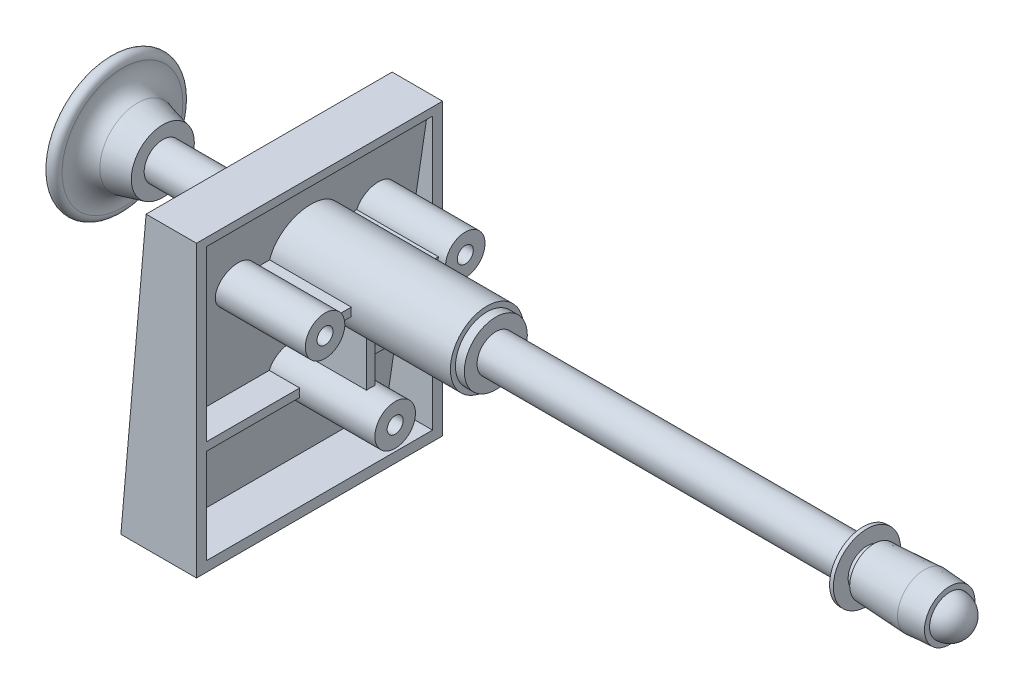
from build123d import *
from build123d.topology import SkipClean

# Parameters (mm, degrees)
SKETCH1_W                       = 61.976
SKETCH1_H                       = 73.025
BOSS_EXTRUDE1_DEPTH             = 19.05
CUT_EXTRUDE1_DEPTH              = 98.655403
SKETCH4_W                       = 55.626
SKETCH4_H                       = 66.950567
CUT_EXTRUDE3_DEPTH              = 3.175
CUT_EXTRUDE5_REACH              = 83.583
SKETCH3_W                       = 56.896
SKETCH3_H                       = 68.4911
BOSS_EXTRUDE2_REACH             = 83.583
BOSS_EXTRUDE4_START             = 19.05
SKETCH12_R                      = 5.11175
BOSS_EXTRUDE4_DEPTH             = 19.05
BOSS_EXTRUDE3_REACH             = 83.583
BOSS_EXTRUDE3_DIRECTION_2_DEPTH = 19.05
CUT_EXTRUDE6_DEPTH              = 6.1214
CUT_EXTRUDE7_DEPTH              = 1.905
BOSS_EXTRUDE5_START             = 23.114
SKETCH15_R                      = 9.2075
BOSS_EXTRUDE5_DEPTH             = 23.114
SKETCH16_R                      = 7.9375
BOSS_EXTRUDE6_DEPTH             = 2.2352
F_10_32_TAPPED_HOLE1_D          = 4.0386
F_10_32_TAPPED_HOLE1_DEPTH      = 22.86
F_10_32_TAPPED_HOLE1_TIP        = 1.213318
SKETCH17_R                      = 4.73075
BOSS_EXTRUDE7_DEPTH             = 95.25
SKETCH19_R                      = 8.4582
BOSS_EXTRUDE8_DEPTH             = 0.9525
BOSS_EXTRUDE9_REACH             = 201.297
SKETCH24_R                      = 9.2075
BOSS_EXTRUDE10_START            = 1.3716
SKETCH25_R                      = 7.9375
BOSS_EXTRUDE10_DEPTH            = 1.3716
SKETCH26_R                      = 4.69265
BOSS_EXTRUDE11_DEPTH            = 19.05


with BuildPart() as part:
    # Sketch1 → Boss-Extrude1 (new body)
    with BuildSketch(Plane(origin=(0, 0, 0), x_dir=(0, 0, -1), z_dir=(1, 0, 0))):
        with Locations((0, 36.5125)):
            Rectangle(SKETCH1_W, SKETCH1_H)
    extrude(amount=-BOSS_EXTRUDE1_DEPTH)

    # Sketch2 → Cut-Extrude1 (cut, through all)
    with BuildSketch(Plane.XY.offset(30.988)):
        Polygon((-12.7, 73.025), (-19.05, 0), (-19.05, 73.025), align=None)
    extrude(amount=-CUT_EXTRUDE1_DEPTH, mode=Mode.SUBTRACT)

    # Sketch4 → Cut-Extrude3 (cut)
    with BuildSketch(Plane(origin=(-18.907036, 1.64409, 0), x_dir=(0, 0, 1), z_dir=(-0.9962405881956831, 0.08662961636484201, 0))):
        with Locations((0, 34.999989)):
            Rectangle(SKETCH4_W, SKETCH4_H)
    extrude(amount=-CUT_EXTRUDE3_DEPTH, mode=Mode.SUBTRACT)

    # Cut-Extrude5: up to this plane
    cut_extrude5_end = Plane(origin=(-11.663084, 1.746979, 0), z_dir=(-0.9889672225345182, 0.14813450898545183, 0))
    # Sketch3 → Cut-Extrude5 (cut, up to the surface)
    with BuildSketch(Plane(origin=(0, 0, 0), x_dir=(0, 0, -1), z_dir=(1, 0, 0)), mode=Mode.PRIVATE) as cut_extrude5_sk1:
        with Locations((0, 36.78555)):
            Rectangle(SKETCH3_W, SKETCH3_H)
    cut_extrude5_tool1 = split(extrude(cut_extrude5_sk1.sketch, amount=-CUT_EXTRUDE5_REACH, mode=Mode.PRIVATE), bisect_by=cut_extrude5_end, keep=Keep.BOTH, mode=Mode.PRIVATE)
    add(cut_extrude5_tool1.solids().sort_by_distance((0, 36.78555, 0))[0], mode=Mode.SUBTRACT)

    # Boss-Extrude2: up to this plane
    boss_extrude2_end = Plane(origin=(-11.663084, 1.746979, 0), z_dir=(-0.9889672225345182, 0.14813450898545183, 0))
    # Sketch9 → Boss-Extrude2 (add, up to the surface)
    with BuildSketch(Plane(origin=(0, 0, 0), x_dir=(0, 0, -1), z_dir=(1, 0, 0)), mode=Mode.PRIVATE) as boss_extrude2_sk1:
        with BuildLine():
            Line((-5.004545, 28.4607), (-28.448, 28.4607))
            Line((-28.448, 28.4607), (-28.448, 26.3779))
            Line((-28.448, 26.3779), (-5.004545, 26.3779))
            ThreePointArc((-5.004545, 26.3779), (0, 22.30755), (5.004545, 26.3779))
            Line((5.004545, 26.3779), (28.448, 26.3779))
            Line((28.448, 26.3779), (28.448, 28.4607))
            Line((28.448, 28.4607), (5.004545, 28.4607))
            ThreePointArc((5.004545, 28.4607), (0, 32.53105), (-5.004545, 28.4607))
        make_face()
    boss_extrude2_tool1 = split(extrude(boss_extrude2_sk1.sketch, amount=-BOSS_EXTRUDE2_REACH, mode=Mode.PRIVATE), bisect_by=boss_extrude2_end, keep=Keep.BOTH, mode=Mode.PRIVATE)
    add(boss_extrude2_tool1.solids().sort_by_distance((0, 27.4193, 0))[0])

    # Sketch12 → Boss-Extrude4 (add)
    with BuildSketch(Plane(origin=(0, 0, 0), x_dir=(0, 0, -1), z_dir=(1, 0, 0)).offset(BOSS_EXTRUDE4_START)):
        with Locations((0, 27.4193)):
            Circle(SKETCH12_R)
    extrude(amount=-BOSS_EXTRUDE4_DEPTH)

    # Boss-Extrude3: up to this plane
    boss_extrude3_end = Plane(origin=(-11.663084, 1.746979, 0), z_dir=(-0.9889672225345182, 0.14813450898545183, 0))
    # Sketch11 → Boss-Extrude3 (add, up to the surface)
    with BuildSketch(Plane(origin=(0, 0, 0), x_dir=(0, 0, -1), z_dir=(1, 0, 0)), mode=Mode.PRIVATE) as boss_extrude3_sk1:
        with BuildLine():
            Line((-1.0414, 46.560133), (-1.0414, 32.423845))
            ThreePointArc((-1.0414, 32.423845), (0, 32.53105), (1.0414, 32.423845))
            Line((1.0414, 32.423845), (1.0414, 46.560133))
            ThreePointArc((1.0414, 46.560133), (6.510686, 49.197864), (9.148417, 54.66715))
            Line((9.148417, 54.66715), (12.797584, 54.66715))
            ThreePointArc((12.797584, 54.66715), (22.6314, 55.70855), (12.797584, 56.74995))
            Line((12.797584, 56.74995), (9.148417, 56.74995))
            ThreePointArc((9.148417, 56.74995), (0, 64.91605), (-9.148417, 56.74995))
            Line((-9.148417, 56.74995), (-12.797584, 56.74995))
            ThreePointArc((-12.797584, 56.74995), (-22.6314, 55.70855), (-12.797584, 54.66715))
            Line((-12.797584, 54.66715), (-9.148417, 54.66715))
            ThreePointArc((-9.148417, 54.66715), (-6.510686, 49.197864), (-1.0414, 46.560133))
        make_face()
    boss_extrude3_tool1 = split(extrude(boss_extrude3_sk1.sketch, amount=-BOSS_EXTRUDE3_REACH, mode=Mode.PRIVATE), bisect_by=boss_extrude3_end, keep=Keep.BOTH, mode=Mode.PRIVATE)
    add(boss_extrude3_tool1.solids().sort_by_distance((0, 54.692148, 0))[0])

    # Sketch11 → Boss-Extrude3 direction 2 (add)
    with BuildSketch(Plane(origin=(0, 0, 0), x_dir=(0, 0, -1), z_dir=(1, 0, 0))):
        with BuildLine():
            Line((-1.0414, 46.560133), (-1.0414, 32.423845))
            ThreePointArc((-1.0414, 32.423845), (0, 32.53105), (1.0414, 32.423845))
            Line((1.0414, 32.423845), (1.0414, 46.560133))
            ThreePointArc((1.0414, 46.560133), (6.510686, 49.197864), (9.148417, 54.66715))
            Line((9.148417, 54.66715), (12.797584, 54.66715))
            ThreePointArc((12.797584, 54.66715), (22.6314, 55.70855), (12.797584, 56.74995))
            Line((12.797584, 56.74995), (9.148417, 56.74995))
            ThreePointArc((9.148417, 56.74995), (0, 64.91605), (-9.148417, 56.74995))
            Line((-9.148417, 56.74995), (-12.797584, 56.74995))
            ThreePointArc((-12.797584, 56.74995), (-22.6314, 55.70855), (-12.797584, 54.66715))
            Line((-12.797584, 54.66715), (-9.148417, 54.66715))
            ThreePointArc((-9.148417, 54.66715), (-6.510686, 49.197864), (-1.0414, 46.560133))
        make_face()
    extrude(amount=BOSS_EXTRUDE3_DIRECTION_2_DEPTH)

    # Sketch13 → Cut-Extrude6 (cut)
    with BuildSketch(Plane(origin=(19.05, 0, 0), x_dir=(0, 0, -1), z_dir=(1, 0, 0))):
        with BuildLine():
            Line((-1.0414, 46.560133), (-1.0414, 32.423845))
            ThreePointArc((-1.0414, 32.423845), (0, 32.53105), (1.0414, 32.423845))
            Line((1.0414, 32.423845), (1.0414, 46.560133))
            ThreePointArc((1.0414, 46.560133), (0, 46.50105), (-1.0414, 46.560133))
        make_face()
    extrude(amount=-CUT_EXTRUDE6_DEPTH, mode=Mode.SUBTRACT)

    # Sketch14 → Cut-Extrude7 (cut)
    with SkipClean():  # the faces are left unmerged after this step: merging them gives an invalid solid
        with BuildSketch(Plane(origin=(19.05, 0, 0), x_dir=(0, 0, -1), z_dir=(1, 0, 0))):
            with BuildLine():
                Line((-9.148417, 54.66715), (-12.797584, 54.66715))
                ThreePointArc((-12.797584, 54.66715), (-12.6873, 55.70855), (-12.797584, 56.74995))
                Line((-12.797584, 56.74995), (-9.148417, 56.74995))
                ThreePointArc((-9.148417, 56.74995), (-9.2075, 55.70855), (-9.148417, 54.66715))
            make_face()
            with BuildLine():
                Line((9.148417, 54.66715), (12.797584, 54.66715))
                ThreePointArc((12.797584, 54.66715), (12.6873, 55.70855), (12.797584, 56.74995))
                Line((12.797584, 56.74995), (9.148417, 56.74995))
                ThreePointArc((9.148417, 56.74995), (9.2075, 55.70855), (9.148417, 54.66715))
            make_face()
        extrude(amount=-CUT_EXTRUDE7_DEPTH, mode=Mode.SUBTRACT)

    # Sketch15 → Boss-Extrude5 (add)
    with SkipClean():  # the faces are left unmerged after this step: merging them gives an invalid solid
        with BuildSketch(Plane(origin=(19.05, 0, 0), x_dir=(0, 0, -1), z_dir=(1, 0, 0)).offset(BOSS_EXTRUDE5_START)):
            with Locations(Location((0, 55.70855, 0), (0, 0, 173.505753))):
                Circle(SKETCH15_R)
        extrude(amount=-BOSS_EXTRUDE5_DEPTH)

    # Sketch16 → Boss-Extrude6 (add)
    with SkipClean():  # the faces are left unmerged after this step: merging them gives an invalid solid
        with BuildSketch(Plane(origin=(42.164, 0, 0), x_dir=(0, 0, -1), z_dir=(1, 0, 0))):
            with Locations((0, 55.70855)):
                Circle(SKETCH16_R)
        extrude(amount=BOSS_EXTRUDE6_DEPTH)

    # #10-32 Tapped Hole1
    with Locations(Plane(origin=(19.05, 0, 0), x_dir=(0, 0, -1), z_dir=(1, 0, 0))):
        with Locations((-17.65935, 55.70855), (17.65935, 55.70855), (0, 27.4193)):
            Hole(F_10_32_TAPPED_HOLE1_D / 2, depth=F_10_32_TAPPED_HOLE1_DEPTH)
            with Locations((0, 0, -(F_10_32_TAPPED_HOLE1_DEPTH + F_10_32_TAPPED_HOLE1_TIP / 2))):  # 118° drill point
                Cone(0, F_10_32_TAPPED_HOLE1_D / 2, F_10_32_TAPPED_HOLE1_TIP, mode=Mode.SUBTRACT)

    # Sketch17 → Boss-Extrude7 (add)
    with SkipClean():  # the faces are left unmerged after this step: merging them gives an invalid solid
        with BuildSketch(Plane(origin=(44.3992, 0, 0), x_dir=(0, 0, -1), z_dir=(1, 0, 0))):
            with Locations((0, 55.70855)):
                Circle(SKETCH17_R)
        extrude(amount=BOSS_EXTRUDE7_DEPTH)

    # Sketch18 → Revolve1 (revolve)
    with SkipClean():  # the faces are left unmerged after this step: merging them gives an invalid solid
        with BuildSketch(Plane.XY, mode=Mode.PRIVATE) as revolve1_sk:
            with BuildLine():
                Line((139.6492, 55.70855), (163.7792, 55.70855))
                ThreePointArc((163.7792, 55.70855), (162.296882, 59.287182), (158.71825, 60.7695))
                Line((158.71825, 60.7695), (158.71825, 62.05855))
                Line((158.71825, 62.05855), (152.36825, 62.50305))
                Line((152.36825, 62.50305), (139.6492, 61.82995))
                Line((139.6492, 61.82995), (139.6492, 55.70855))
            make_face()
        revolve(revolve1_sk.sketch.rotate(Axis((139.6492, 55.70855, 0), (1, 0, 0)), 83.505753), axis=Axis((139.6492, 55.70855, 0), (1, 0, 0)))

    # Sketch19 → Boss-Extrude8 (add)
    with SkipClean():  # the faces are left unmerged after this step: merging them gives an invalid solid
        with BuildSketch(Plane.ZY.offset(-137.8712)):
            with Locations(Location((0, 55.70855, 0), (0, 0, 180))):
                Circle(SKETCH19_R)
        extrude(amount=BOSS_EXTRUDE8_DEPTH)

    # Boss-Extrude9: up to this plane
    with SkipClean():  # the faces are left unmerged after this step: merging them gives an invalid solid
        boss_extrude9_end = Plane(origin=(-15.743972, 1.369041, 0), z_dir=(-0.996240588195683, 0.086629616364842, 0))
        # Sketch24 → Boss-Extrude9 (add, up to the surface)
        with BuildSketch(Plane(origin=(-19.05, 0, 0), x_dir=(0, 0, -1), z_dir=(1, 0, 0)), mode=Mode.PRIVATE) as boss_extrude9_sk1:
            with Locations(Location((0, 55.70855, 0), (0, 0, 173.505753))):
                Circle(SKETCH24_R)
        boss_extrude9_tool1 = split(extrude(boss_extrude9_sk1.sketch, amount=BOSS_EXTRUDE9_REACH, mode=Mode.PRIVATE), bisect_by=boss_extrude9_end, keep=Keep.BOTH, mode=Mode.PRIVATE)
        add(boss_extrude9_tool1.solids().sort_by_distance((-19.05, 55.70855, 0))[0])

    # Sketch25 → Boss-Extrude10 (add)
    with SkipClean():  # the faces are left unmerged after this step: merging them gives an invalid solid
        with BuildSketch(Plane.ZY.offset(19.05).offset(BOSS_EXTRUDE10_START)):
            with Locations(Location((0, 55.70855, 0), (0, 0, 180))):
                Circle(SKETCH25_R)
        extrude(amount=-BOSS_EXTRUDE10_DEPTH)

    # Sketch26 → Boss-Extrude11 (add)
    with SkipClean():  # the faces are left unmerged after this step: merging them gives an invalid solid
        with BuildSketch(Plane.ZY.offset(20.4216)):
            with Locations(Location((0, 55.70855, 0), (0, 0, 180))):
                Circle(SKETCH26_R)
        extrude(amount=BOSS_EXTRUDE11_DEPTH)

    # Sketch27 → Revolve2 (revolve)
    with SkipClean():  # the faces are left unmerged after this step: merging them gives an invalid solid
        with BuildSketch(Plane.XY, mode=Mode.PRIVATE) as revolve2_sk:
            with BuildLine():
                Line((-39.4716, 55.70855), (-58.5216, 55.70855))
                ThreePointArc((-58.5216, 55.70855), (-58.200534, 58.738071), (-57.2516, 61.632999))
                Line((-57.2516, 61.632999), (-52.679761, 71.806607))
                ThreePointArc((-52.679761, 71.806607), (-50.769172, 72.68845), (-49.6316, 70.91816))
                ThreePointArc((-49.6316, 70.91816), (-48.821432, 67.342065), (-45.8216, 65.23355))
                Line((-45.8216, 65.23355), (-39.4716, 63.64605))
                Line((-39.4716, 63.64605), (-39.4716, 55.70855))
            make_face()
        revolve(revolve2_sk.sketch.rotate(Axis((-39.4716, 55.70855, 0), (-1, 0, 0)), 276.494247), axis=Axis((-39.4716, 55.70855, 0), (-1, 0, 0)))


solid = part.part
